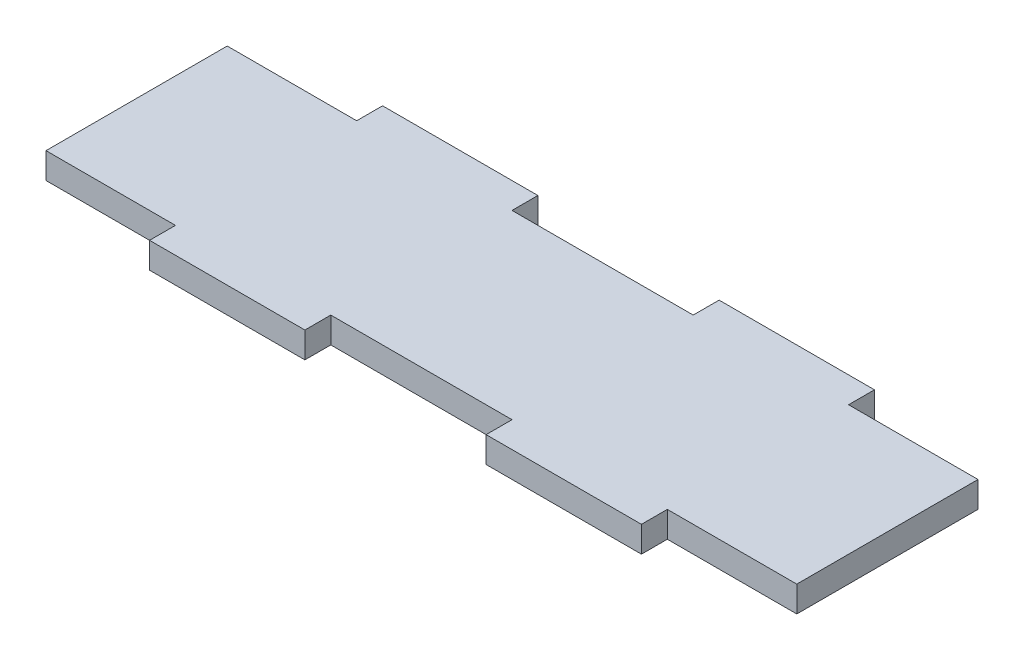
from build123d import *

# Parameters (mm, degrees)
BOSS_EXTRU_1_DEPTH = 10


with BuildPart() as part:
    # Esquisse1 → Boss.-Extru.1 (new body)
    with BuildSketch(Plane(origin=(0, 0, 0), x_dir=(1, 0, 0), z_dir=(0, 1, 0))):
        Polygon((0, 10), (50, 10), (50, 0), (110, 0), (110, 10), (180, 10), (180, 0), (240, 0), (240, 10), (290, 10), (290, 80), (240, 80), (240, 90), (180, 90), (180, 80), (110, 80), (110, 90), (50, 90), (50, 80), (0, 80), align=None)
    extrude(amount=BOSS_EXTRU_1_DEPTH)


solid = part.part
